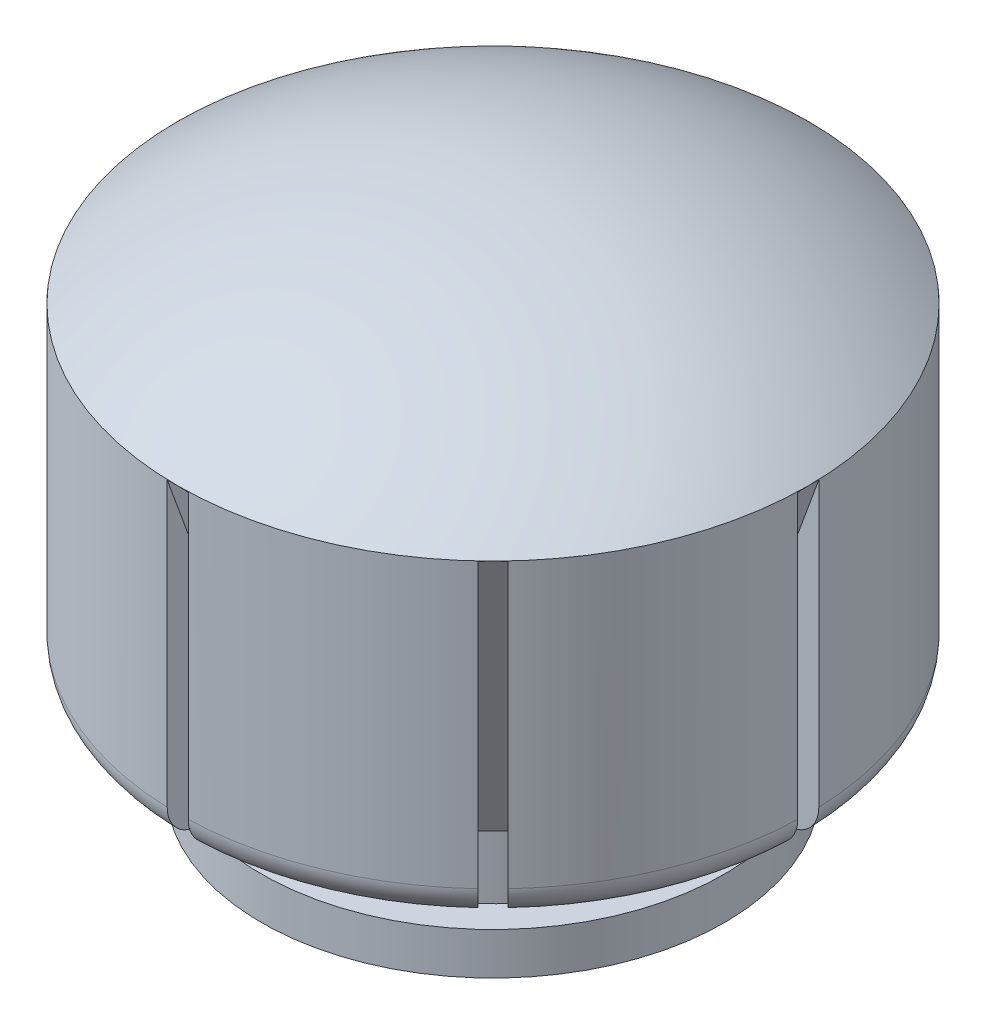
from build123d import *

# Parameters (mm, degrees)
M16_TAPPED_HOLE1_D     = 14
M16_TAPPED_HOLE1_DEPTH = 35
M16_TAPPED_HOLE1_TIP   = 4.206024333
CUT_EXTRUDE1_DEPTH     = 1
CIRPATTERN1_COUNT      = 8
FILLET1_R              = 3


with BuildPart() as part:
    # Sketch3 → Revolve1 (revolve)
    with BuildSketch(Plane.XY, mode=Mode.PRIVATE) as revolve1_sk:
        with BuildLine():
            Line((0, 0), (22, 0))
            Line((22, 0), (22, 4))
            Line((22, 4), (19, 4))
            Line((19, 4), (19, 10))
            Line((19, 10), (30, 10))
            Line((30, 10), (30, 40))
            ThreePointArc((30, 40), (15.811388301, 47.434164903), (0, 50))
            Line((0, 50), (0, 0))
        make_face()
    revolve(revolve1_sk.sketch.rotate(Axis((0, 0, 0), (0, 1, 0)), 90), axis=Axis((0, 0, 0), (0, 1, 0)))

    # M16 Tapped Hole1
    with Locations(Plane.XZ):
        with Locations((0, 0)):
            Hole(M16_TAPPED_HOLE1_D / 2, depth=M16_TAPPED_HOLE1_DEPTH)
            with Locations((0, 0, -(M16_TAPPED_HOLE1_DEPTH + M16_TAPPED_HOLE1_TIP / 2))):  # 118° drill point
                Cone(0, M16_TAPPED_HOLE1_D / 2, M16_TAPPED_HOLE1_TIP, mode=Mode.SUBTRACT)

    # Sketch7 → Cut-Extrude1 (cut, symmetric)
    with BuildSketch(Plane.XY):
        Polygon((30, 40), (30, 10), (19, 10), align=None)
    cut_extrude1 = extrude(amount=CUT_EXTRUDE1_DEPTH, both=True, mode=Mode.SUBTRACT)

    # CirPattern1: Cut-Extrude1 ×8 about axis
    cirpattern1_axis = Axis((0, 0, 0), (0, 1, 0))
    for i in range(1, CIRPATTERN1_COUNT):
        add(cut_extrude1.rotate(cirpattern1_axis, i * 360 / CIRPATTERN1_COUNT), mode=Mode.SUBTRACT)

    # Fillet1
    fillet1_edges = [part.edges().sort_by_distance(p)[0] for p in [
        (27.716385975, 10, 11.480502971),
        (11.480502971, 10, 27.716385975),
        (-11.480502971, 10, 27.716385975),
        (-27.716385975, 10, 11.480502971),
        (-27.716385975, 10, -11.480502971),
        (-11.480502971, 10, -27.716385975),
        (11.480502971, 10, -27.716385975),
        (27.716385975, 10, -11.480502971),
    ]]
    fillet(fillet1_edges, radius=FILLET1_R)


solid = part.part
